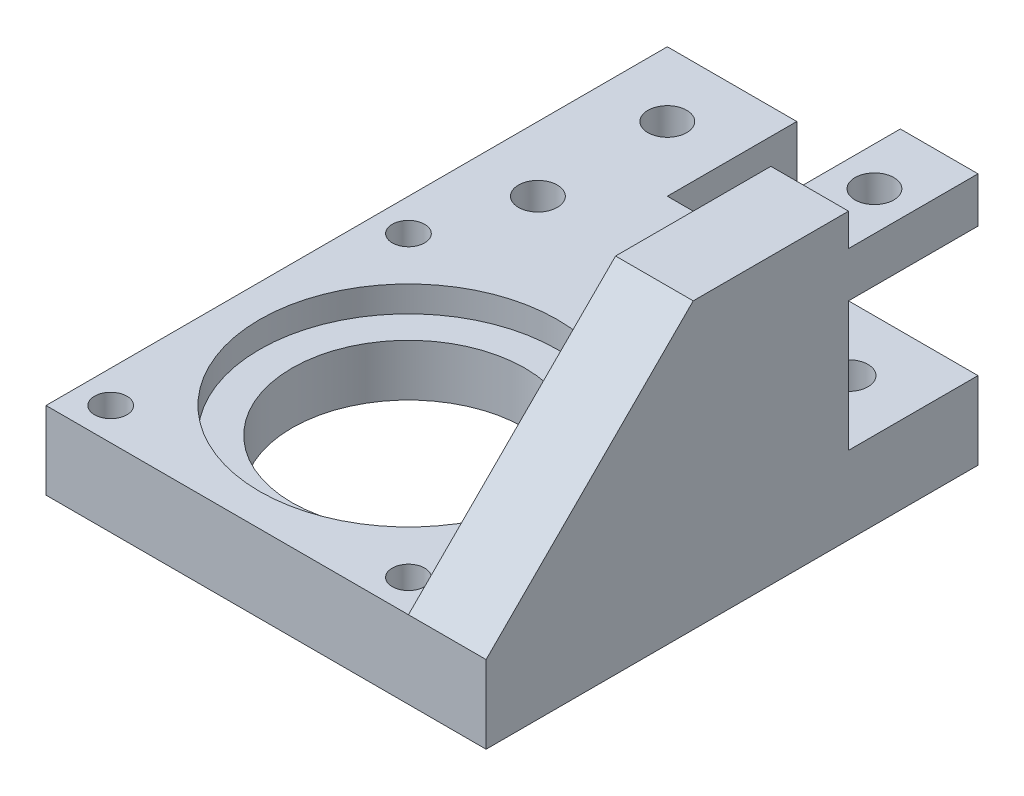
from build123d import *

# Parameters (mm, degrees)
SKETCH2_R           = 9
SKETCH2_W           = 6
SKETCH2_H           = 25.976415094
BOSS_EXTRUDE1_DEPTH = 6
SKETCH3_W           = 10
SKETCH3_H           = 6
BOSS_EXTRUDE2_DEPTH = 10
SKETCH4_W           = 6
SKETCH4_H           = 28
BOSS_EXTRUDE3_DEPTH = 16
CHAMFER1_SIZE       = 16
SKETCH5_W           = 6
SKETCH5_H           = 6
BOSS_EXTRUDE4_DEPTH = 10
CUT_EXTRUDE1_REACH  = 42.175
SKETCH7_R           = 1.5
CUT_EXTRUDE2_REACH  = 42.175
SKETCH6_R           = 1.5
SKETCH9_W           = 6
SKETCH9_H           = 10
CUT_EXTRUDE3_DEPTH  = 2.5
SKETCH10_R          = 3
CUT_EXTRUDE4_DEPTH  = 2.5
SKETCH11_R          = 11.5
CUT_EXTRUDE5_DEPTH  = 2
CUT_EXTRUDE6_REACH  = 39.229
SKETCH13_R          = 1.25


with BuildPart() as part:
    # Sketch2 → Boss-Extrude1 (new body)
    # profile 1 of 2: a face of its own
    with BuildSketch(Plane(origin=(0, 0, 0), x_dir=(1, 0, 0), z_dir=(0, 1, 0))):
        Polygon((-17, 19), (-17, -19), (11, -19), (11, 6.976415094), (17, 6.976415094), (17, 19), align=None)
        with Locations(Location((-3, -5, 0), (0, 0, 270))):
            Circle(SKETCH2_R, mode=Mode.SUBTRACT)
    # profile 2 of 2: a face of its own
    with BuildSketch(Plane(origin=(0, 0, 0), x_dir=(1, 0, 0), z_dir=(0, 1, 0))):
        with Locations((14, -6.011792453)):
            Rectangle(SKETCH2_W, SKETCH2_H)
    extrude(amount=BOSS_EXTRUDE1_DEPTH)

    # Sketch3 → Boss-Extrude2 (add)
    with BuildSketch(Plane(origin=(0, 0, -19), x_dir=(-1, 0, 0), z_dir=(0, 0, -1))):
        with Locations((12, 3)):
            Rectangle(SKETCH3_W, SKETCH3_H)
    extrude(amount=BOSS_EXTRUDE2_DEPTH)

    # Sketch4 → Boss-Extrude3 (add)
    with BuildSketch(Plane(origin=(0, 6, 0), x_dir=(1, 0, 0), z_dir=(0, 1, 0))):
        with Locations((14, -5)):
            Rectangle(SKETCH4_W, SKETCH4_H)
    extrude(amount=BOSS_EXTRUDE3_DEPTH)

    # Chamfer1
    chamfer1_edges = [part.edges().sort_by_distance(p)[0] for p in [
        (14, 22, 19),
    ]]
    chamfer(chamfer1_edges, length=CHAMFER1_SIZE)

    # Sketch5 → Boss-Extrude4 (add)
    with BuildSketch(Plane(origin=(0, 0, -9), x_dir=(-1, 0, 0), z_dir=(0, 0, -1))):
        with Locations((-14, 19)):
            Rectangle(SKETCH5_W, SKETCH5_H)
    extrude(amount=BOSS_EXTRUDE4_DEPTH)

    # Sketch7 → Cut-Extrude1 (cut, up to next)
    with BuildSketch(Plane.XZ, mode=Mode.PRIVATE) as cut_extrude1_sk1:
        with Locations(Location((0, -14, 0), (0, 0, 270))):
            Circle(SKETCH7_R)
    cut_extrude1_tool1 = extrude(cut_extrude1_sk1.sketch, amount=-CUT_EXTRUDE1_REACH, mode=Mode.PRIVATE) & part.part
    # Sketch7 → Cut-Extrude1 (cut, up to next)
    with BuildSketch(Plane.XZ, mode=Mode.PRIVATE) as cut_extrude1_sk2:
        with Locations(Location((-12, -14, 0), (0, 0, 270))):
            Circle(SKETCH7_R)
    cut_extrude1_tool2 = extrude(cut_extrude1_sk2.sketch, amount=-CUT_EXTRUDE1_REACH, mode=Mode.PRIVATE) & part.part
    # Sketch7 → Cut-Extrude1 (cut, up to next)
    with BuildSketch(Plane.XZ, mode=Mode.PRIVATE) as cut_extrude1_sk3:
        with Locations(Location((-12, -24, 0), (0, 0, 270))):
            Circle(SKETCH7_R)
    cut_extrude1_tool3 = extrude(cut_extrude1_sk3.sketch, amount=-CUT_EXTRUDE1_REACH, mode=Mode.PRIVATE) & part.part
    # Sketch7 → Cut-Extrude1 (cut, up to next)
    with BuildSketch(Plane.XZ, mode=Mode.PRIVATE) as cut_extrude1_sk4:
        with Locations(Location((12, -14, 0), (0, 0, 90))):
            Circle(SKETCH7_R)
    cut_extrude1_tool4 = extrude(cut_extrude1_sk4.sketch, amount=-CUT_EXTRUDE1_REACH, mode=Mode.PRIVATE) & part.part
    add(cut_extrude1_tool1.solids().sort_by_distance((0, 0, -14))[0], mode=Mode.SUBTRACT)
    add(cut_extrude1_tool2.solids().sort_by_distance((-12, 0, -14))[0], mode=Mode.SUBTRACT)
    add(cut_extrude1_tool3.solids().sort_by_distance((-12, 0, -24))[0], mode=Mode.SUBTRACT)
    add(cut_extrude1_tool4.solids().sort_by_distance((12, 0, -14))[0], mode=Mode.SUBTRACT)

    # Sketch6 → Cut-Extrude2 (cut, up to next)
    with BuildSketch(Plane.XZ.offset(-22), mode=Mode.PRIVATE) as cut_extrude2_sk1:
        with Locations(Location((14, -14, 0), (0, 0, 90))):
            Circle(SKETCH6_R)
    cut_extrude2_tool1 = extrude(cut_extrude2_sk1.sketch, amount=CUT_EXTRUDE2_REACH, mode=Mode.PRIVATE) & part.part
    add(cut_extrude2_tool1.solids().sort_by_distance((14, 22, -14))[0], mode=Mode.SUBTRACT)

    # Sketch9 → Cut-Extrude3 (cut)
    with BuildSketch(Plane(origin=(0, 22, 0), x_dir=(1, 0, 0), z_dir=(0, 1, 0))):
        with Locations((14, 14)):
            Rectangle(SKETCH9_W, SKETCH9_H)
    extrude(amount=-CUT_EXTRUDE3_DEPTH, mode=Mode.SUBTRACT)

    # Sketch10 → Cut-Extrude4 (cut)
    with BuildSketch(Plane.XZ):
        with Locations(Location((12, -14, 0), (0, 0, 270))):
            Circle(SKETCH10_R)
        with Locations(Location((0, -14, 0), (0, 0, 270))):
            Circle(SKETCH10_R)
        with Locations(Location((-12, -14, 0), (0, 0, 270))):
            Circle(SKETCH10_R)
        with Locations(Location((-12, -24, 0), (0, 0, 270))):
            Circle(SKETCH10_R)
    extrude(amount=-CUT_EXTRUDE4_DEPTH, mode=Mode.SUBTRACT)

    # Sketch11 → Cut-Extrude5 (cut)
    with BuildSketch(Plane(origin=(0, 6, 0), x_dir=(1, 0, 0), z_dir=(0, 1, 0))):
        with Locations(Location((-3, -5, 0), (0, 0, 270))):
            Circle(SKETCH11_R)
    extrude(amount=-CUT_EXTRUDE5_DEPTH, mode=Mode.SUBTRACT)

    # Sketch13 → Cut-Extrude6 (cut, up to next)
    with BuildSketch(Plane(origin=(0, 6, 0), x_dir=(1, 0, 0), z_dir=(0, 1, 0)), mode=Mode.PRIVATE) as cut_extrude6_sk1:
        with Locations(Location((-14.5, 6.5, 0), (0, 0, 270))):
            Circle(SKETCH13_R)
    cut_extrude6_tool1 = extrude(cut_extrude6_sk1.sketch, amount=-CUT_EXTRUDE6_REACH, mode=Mode.PRIVATE) & part.part
    # Sketch13 → Cut-Extrude6 (cut, up to next)
    with BuildSketch(Plane(origin=(0, 6, 0), x_dir=(1, 0, 0), z_dir=(0, 1, 0)), mode=Mode.PRIVATE) as cut_extrude6_sk2:
        with Locations(Location((8.5, 6.5, 0), (0, 0, 270))):
            Circle(SKETCH13_R)
    cut_extrude6_tool2 = extrude(cut_extrude6_sk2.sketch, amount=-CUT_EXTRUDE6_REACH, mode=Mode.PRIVATE) & part.part
    # Sketch13 → Cut-Extrude6 (cut, up to next)
    with BuildSketch(Plane(origin=(0, 6, 0), x_dir=(1, 0, 0), z_dir=(0, 1, 0)), mode=Mode.PRIVATE) as cut_extrude6_sk3:
        with Locations(Location((8.5, -16.5, 0), (0, 0, 270))):
            Circle(SKETCH13_R)
    cut_extrude6_tool3 = extrude(cut_extrude6_sk3.sketch, amount=-CUT_EXTRUDE6_REACH, mode=Mode.PRIVATE) & part.part
    # Sketch13 → Cut-Extrude6 (cut, up to next)
    with BuildSketch(Plane(origin=(0, 6, 0), x_dir=(1, 0, 0), z_dir=(0, 1, 0)), mode=Mode.PRIVATE) as cut_extrude6_sk4:
        with Locations(Location((-14.5, -16.5, 0), (0, 0, 270))):
            Circle(SKETCH13_R)
    cut_extrude6_tool4 = extrude(cut_extrude6_sk4.sketch, amount=-CUT_EXTRUDE6_REACH, mode=Mode.PRIVATE) & part.part
    add(cut_extrude6_tool1.solids().sort_by_distance((-14.5, 6, -6.5))[0], mode=Mode.SUBTRACT)
    add(cut_extrude6_tool2.solids().sort_by_distance((8.5, 6, -6.5))[0], mode=Mode.SUBTRACT)
    add(cut_extrude6_tool3.solids().sort_by_distance((8.5, 6, 16.5))[0], mode=Mode.SUBTRACT)
    add(cut_extrude6_tool4.solids().sort_by_distance((-14.5, 6, 16.5))[0], mode=Mode.SUBTRACT)


solid = part.part
